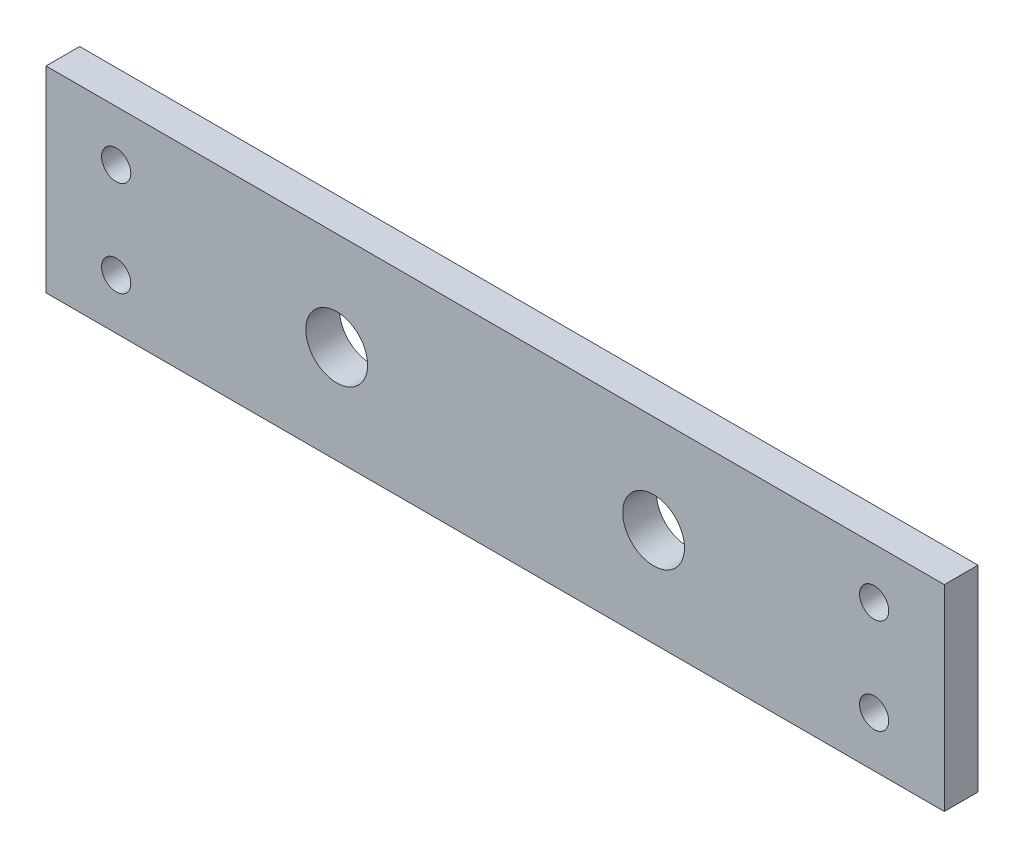
from build123d import *

# Parameters (mm, degrees)
SKETCH1_W           = 160
SKETCH1_H           = 35
BOSS_EXTRUDE1_DEPTH = 6
CUT_EXTRUDE1_REACH  = 84.111
SKETCH2_R           = 2.6
CUT_EXTRUDE2_REACH  = 84.111
SKETCH3_R           = 5.5


with BuildPart() as part:
    # Sketch1 → Boss-Extrude1 (new body)
    with BuildSketch(Plane.XY):
        Rectangle(SKETCH1_W, SKETCH1_H)
    extrude(amount=BOSS_EXTRUDE1_DEPTH)

    # Sketch2 → Cut-Extrude1 (cut, up to next)
    with BuildSketch(Plane.XY.offset(6), mode=Mode.PRIVATE) as cut_extrude1_sk1:
        with Locations((67.5, 8.5)):
            Circle(SKETCH2_R)
    cut_extrude1_tool1 = extrude(cut_extrude1_sk1.sketch, amount=-CUT_EXTRUDE1_REACH, mode=Mode.PRIVATE) & part.part
    # Sketch2 → Cut-Extrude1 (cut, up to next)
    with BuildSketch(Plane.XY.offset(6), mode=Mode.PRIVATE) as cut_extrude1_sk2:
        with Locations((67.5, -8.5)):
            Circle(SKETCH2_R)
    cut_extrude1_tool2 = extrude(cut_extrude1_sk2.sketch, amount=-CUT_EXTRUDE1_REACH, mode=Mode.PRIVATE) & part.part
    # Sketch2 → Cut-Extrude1 (cut, up to next)
    with BuildSketch(Plane.XY.offset(6), mode=Mode.PRIVATE) as cut_extrude1_sk3:
        with Locations((-67.5, 8.5)):
            Circle(SKETCH2_R)
    cut_extrude1_tool3 = extrude(cut_extrude1_sk3.sketch, amount=-CUT_EXTRUDE1_REACH, mode=Mode.PRIVATE) & part.part
    # Sketch2 → Cut-Extrude1 (cut, up to next)
    with BuildSketch(Plane.XY.offset(6), mode=Mode.PRIVATE) as cut_extrude1_sk4:
        with Locations((-67.5, -8.5)):
            Circle(SKETCH2_R)
    cut_extrude1_tool4 = extrude(cut_extrude1_sk4.sketch, amount=-CUT_EXTRUDE1_REACH, mode=Mode.PRIVATE) & part.part
    add(cut_extrude1_tool1.solids().sort_by_distance((67.5, 8.5, 6))[0], mode=Mode.SUBTRACT)
    add(cut_extrude1_tool2.solids().sort_by_distance((67.5, -8.5, 6))[0], mode=Mode.SUBTRACT)
    add(cut_extrude1_tool3.solids().sort_by_distance((-67.5, 8.5, 6))[0], mode=Mode.SUBTRACT)
    add(cut_extrude1_tool4.solids().sort_by_distance((-67.5, -8.5, 6))[0], mode=Mode.SUBTRACT)

    # Sketch3 → Cut-Extrude2 (cut, up to next)
    with BuildSketch(Plane.XY.offset(6), mode=Mode.PRIVATE) as cut_extrude2_sk1:
        with Locations((28.22, 0)):
            Circle(SKETCH3_R)
    cut_extrude2_tool1 = extrude(cut_extrude2_sk1.sketch, amount=-CUT_EXTRUDE2_REACH, mode=Mode.PRIVATE) & part.part
    # Sketch3 → Cut-Extrude2 (cut, up to next)
    with BuildSketch(Plane.XY.offset(6), mode=Mode.PRIVATE) as cut_extrude2_sk2:
        with Locations((-28.22, 0)):
            Circle(SKETCH3_R)
    cut_extrude2_tool2 = extrude(cut_extrude2_sk2.sketch, amount=-CUT_EXTRUDE2_REACH, mode=Mode.PRIVATE) & part.part
    add(cut_extrude2_tool1.solids().sort_by_distance((28.22, 0, 6))[0], mode=Mode.SUBTRACT)
    add(cut_extrude2_tool2.solids().sort_by_distance((-28.22, 0, 6))[0], mode=Mode.SUBTRACT)


solid = part.part
